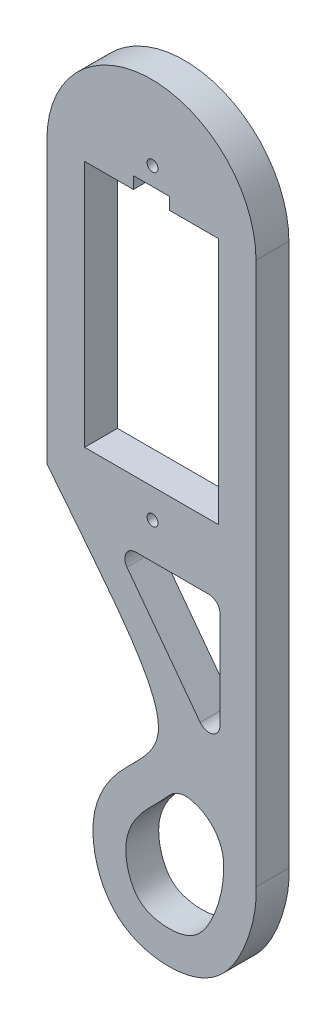
from build123d import *

# Parameters (mm, degrees)
AUFSATZ_LINEAR_AUSTRAGEN1_DEPTH    = 3
F_1_0_1_DURCHMESSER_BOHRUNG1_D     = 1
F_1_0_1_DURCHMESSER_BOHRUNG1_DEPTH = 8
F_1_0_1_DURCHMESSER_BOHRUNG1_TIP   = 0.30043031
SCHNITT_LINEAR_AUSTRAGEN1_DEPTH    = 10
SKIZZE5_W                          = 3.3
SKIZZE5_H                          = 1.1
SCHNITT_LINEAR_AUSTRAGEN2_DEPTH    = 10


with BuildPart() as part:
    # Skizze1 → Aufsatz-Linear austragen1 (new body)
    with BuildSketch(Plane.XY):
        with BuildLine():
            Line((-133.562447252, 119.166291083), (-133.562447252, 93.547346763))
            add(Edge.make_bspline(
                [(-133.562447252, 93.547346763), (-128.013793175, 86.443256326), (-120.197963559, 77.816029383), (-127.469524773, 72.752333885), (-130.169140804, 67.224838893), (-128.040635043, 60.475757597), (-122.169360267, 58.800428332), (-116.191836091, 60.874197718), (-114.311765496, 67.527525691), (-114.482154233, 69.644720578)],
                knots=[0, 0, 0, 0, 0.22572089, 0.353252111, 0.479384812, 0.607669177, 0.727502401, 0.851806894, 1, 1, 1, 1], degree=3))
            Line((-114.482154233, 69.644720578), (-114.482154233, 119.166291083))
            ThreePointArc((-114.482154233, 119.166291083), (-124.022300743, 128.706437592), (-133.562447252, 119.166291083))
        make_face()
        Polygon((-126.022300743, 119.166291083), (-122.022300743, 119.166291083), (-117.922300743, 119.166291083), (-117.922300743, 96.566291083), (-130.122300743, 96.566291083), (-130.122300743, 119.166291083), align=None, mode=Mode.SUBTRACT)
        with BuildLine():
            Line((-125.45119226, 90.6233266), (-118.777374173, 90.6233266))
            ThreePointArc((-118.777374173, 90.6233266), (-118.070267391, 90.330433381), (-117.777374173, 89.6233266))
            Line((-117.777374173, 89.6233266), (-117.777374173, 80.703073397))
            ThreePointArc((-117.777374173, 80.703073397), (-118.461704126, 79.754204375), (-119.578079016, 80.104014341))
            Line((-119.578079016, 80.104014341), (-126.251897103, 89.024267543))
            ThreePointArc((-126.251897103, 89.024267543), (-126.34535641, 90.071065889), (-125.45119226, 90.6233266))
        make_face(mode=Mode.SUBTRACT)
    extrude(amount=-AUFSATZ_LINEAR_AUSTRAGEN1_DEPTH)

    # Ø1.0 (1) Durchmesser Bohrung1
    with Locations(Plane.XY):
        with Locations((-123.922300743, 121.916291083), (-123.922300743, 93.916291083)):
            Hole(F_1_0_1_DURCHMESSER_BOHRUNG1_D / 2, depth=F_1_0_1_DURCHMESSER_BOHRUNG1_DEPTH)
            with Locations((0, 0, -(F_1_0_1_DURCHMESSER_BOHRUNG1_DEPTH + F_1_0_1_DURCHMESSER_BOHRUNG1_TIP / 2))):  # 118° drill point
                Cone(0, F_1_0_1_DURCHMESSER_BOHRUNG1_D / 2, F_1_0_1_DURCHMESSER_BOHRUNG1_TIP, mode=Mode.SUBTRACT)

    # Skizze4 → Schnitt-Linear austragen1 (cut)
    with BuildSketch(Plane.XY):
        with BuildLine():
            ThreePointArc((-117.472485981, 69.404063067), (-118.172275009, 72.13942513), (-120.595173245, 73.589071445))
            ThreePointArc((-120.595173245, 73.589071445), (-121.588024533, 73.485821424), (-122.407312458, 72.915574512))
            add(Edge.make_bspline(
                [(-122.407312458, 72.915574512), (-122.746543092, 72.521322498), (-123.084101687, 72.174768995), (-123.798751665, 71.45557614), (-124.164666351, 71.099380602), (-124.618877178, 70.619005764), (-124.751184868, 70.471981366), (-125.000827495, 70.175278509), (-125.117556476, 70.026630412), (-125.443227957, 69.580861957), (-125.627517044, 69.284119268), (-125.93266916, 68.69392072), (-126.053679968, 68.400608069), (-126.237319326, 67.811620539), (-126.300218029, 67.515886305), (-126.351713498, 67.058456155), (-126.361635403, 66.904500193), (-126.366451397, 66.583779749), (-126.361253322, 66.417569525), (-126.321813676, 65.910947758), (-126.263292648, 65.562666155), (-126.088206334, 64.894180477), (-125.971616292, 64.574135603), (-125.701362116, 64.006175706), (-125.547781703, 63.758840537), (-125.316666988, 63.463794922), (-125.241012759, 63.37929359), (-125.088532461, 63.229378343), (-125.006959649, 63.159206644), (-124.742369309, 62.960067469), (-124.538633456, 62.841976548), (-124.069770902, 62.640378887), (-123.804866136, 62.557583932), (-123.229305718, 62.439649895), (-122.918998874, 62.404690041), (-122.440121841, 62.392136745), (-122.276734617, 62.394563517), (-121.962211578, 62.412183617), (-121.809947481, 62.427391204), (-121.36991516, 62.491559289), (-121.099580382, 62.558798956), (-120.60077366, 62.740145004), (-120.371950204, 62.853593654), (-119.934035758, 63.141575241), (-119.723921168, 63.316288807), (-119.409882914, 63.656314491), (-119.306643748, 63.781496754), (-119.088736247, 64.080131512), (-118.976554514, 64.250724495), (-118.644154955, 64.812072413), (-118.428883064, 65.252287661), (-118.052550193, 66.184076389), (-117.89094429, 66.675861274), (-117.641925252, 67.628292551), (-117.554732373, 68.089811838), (-117.484346109, 68.684471406), (-117.470864491, 68.866232921), (-117.461039299, 69.179140188), (-117.464949001, 69.310411013), (-117.472485981, 69.404063067)],
                knots=[0.287652122, 0.287652122, 0.287652122, 0.287652122, 0.3125, 0.3125, 0.34375, 0.34375, 0.359375, 0.359375, 0.375, 0.375, 0.40625, 0.40625, 0.4375, 0.4375, 0.46875, 0.46875, 0.484375, 0.484375, 0.5, 0.5, 0.53125, 0.53125, 0.5625, 0.5625, 0.59375, 0.59375, 0.609375, 0.609375, 0.625, 0.625, 0.65625, 0.65625, 0.6875, 0.6875, 0.71875, 0.71875, 0.734375, 0.734375, 0.75, 0.75, 0.78125, 0.78125, 0.8125, 0.8125, 0.84375, 0.84375, 0.859375, 0.859375, 0.875, 0.875, 0.90625, 0.90625, 0.9375, 0.9375, 0.96875, 0.96875, 0.984375, 0.984375, 1, 1, 1, 1], degree=3))
        make_face()
    extrude(amount=-SCHNITT_LINEAR_AUSTRAGEN1_DEPTH, mode=Mode.SUBTRACT)

    # Skizze5 → Schnitt-Linear austragen2 (cut)
    with BuildSketch(Plane.XY):
        with Locations((-124.022300743, 119.716291083)):
            Rectangle(SKIZZE5_W, SKIZZE5_H)
    extrude(amount=-SCHNITT_LINEAR_AUSTRAGEN2_DEPTH, mode=Mode.SUBTRACT)


solid = part.part
